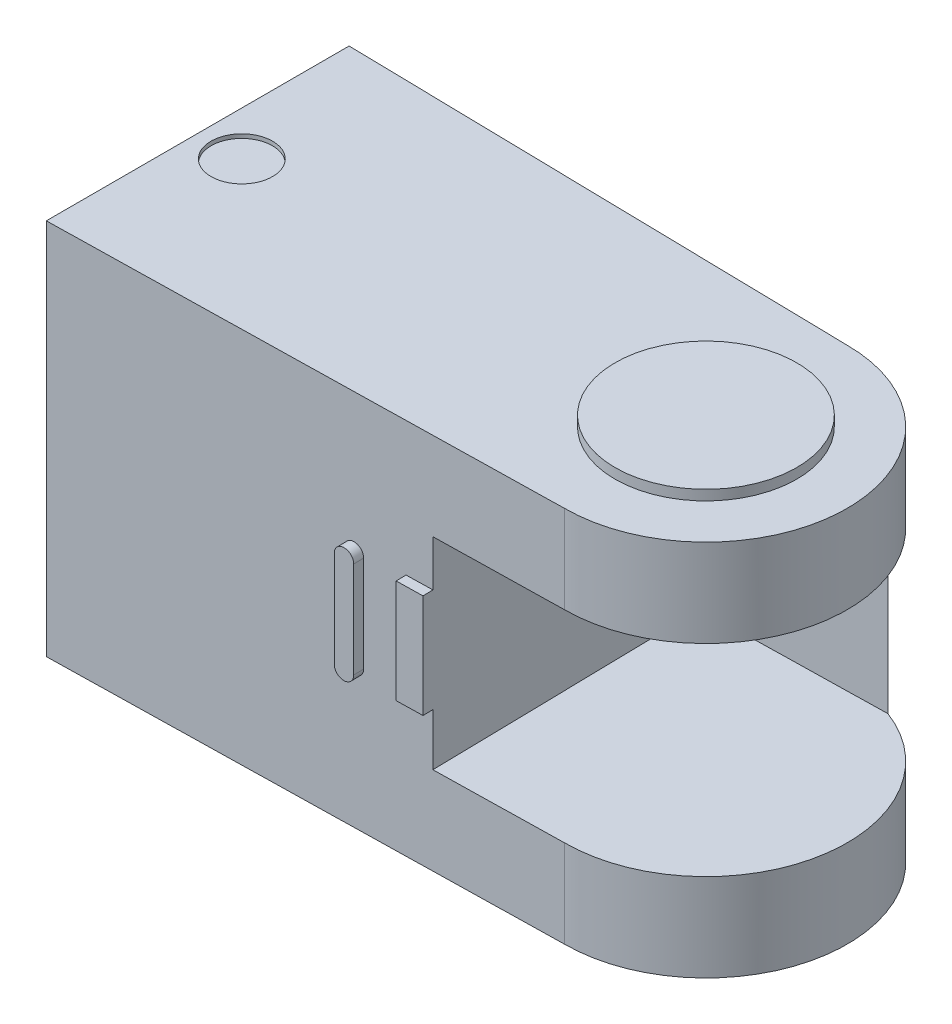
from build123d import *

# Parameters (mm, degrees)
BOSS_EXTRUDE1_DEPTH = 187
CUT_EXTRUDE3_DEPTH  = 135
SKETCH3_W           = 208.90375788
SKETCH3_H           = 100
CUT_EXTRUDE4_DEPTH  = 175
SKETCH4_R           = 45
BOSS_EXTRUDE2_DEPTH = 5
BOSS_EXTRUDE3_START = 5
SKETCH5_R           = 45
BOSS_EXTRUDE3_DEPTH = 5
SKETCH6_W           = 13.051719475
SKETCH6_H           = 51.345683967
BOSS_EXTRUDE4_DEPTH = 5
BOSS_EXTRUDE5_DEPTH = 5
SKETCH8_R           = 15.225
CUT_EXTRUDE6_DEPTH  = 2


with BuildPart() as part:
    # Sketch1 → Boss-Extrude1 (new body)
    with BuildSketch(Plane(origin=(0, 0, 0), x_dir=(1, 0, 0), z_dir=(0, 1, 0))):
        with BuildLine():
            Line((0, 70), (-251.769125683, 75))
            Line((-251.769125683, 75), (-251.769125683, -75))
            Line((-251.769125683, -75), (0, -70))
            ThreePointArc((0, -70), (70, 0), (0, 70))
        make_face()
    extrude(amount=-BOSS_EXTRUDE1_DEPTH)

    # Sketch2 → Cut-Extrude3 (cut)
    with BuildSketch(Plane(origin=(1.38961445, 0, 69.972403001), x_dir=(0.9998028591480678, 0, -0.019855549333850253), z_dir=(0.019855549333850253, 0, 0.9998028591480679))):
        Polygon((-1.389888453, -43.5), (169.277022147, -43.5), (169.277022147, -143.5), (-1.389888453, -143.5), (-65.389888453, -143.5), (-65.389888453, -43.5), align=None)
    extrude(amount=-CUT_EXTRUDE3_DEPTH, mode=Mode.SUBTRACT)

    # Sketch3 → Cut-Extrude4 (cut)
    with BuildSketch(Plane(origin=(-1.29088471, 0, -65.000982984), x_dir=(0.9998028591480678, 0, -0.019855549333850163), z_dir=(0.019855549333850163, 0, 0.9998028591480679))):
        with Locations((39.061990487, -93.5)):
            Rectangle(SKETCH3_W, SKETCH3_H)
    extrude(amount=CUT_EXTRUDE4_DEPTH, mode=Mode.SUBTRACT)

    # Sketch4 → Boss-Extrude2 (add)
    with BuildSketch(Plane(origin=(0, 0, 0), x_dir=(1, 0, 0), z_dir=(0, 1, 0))):
        with Locations(Location((0, 0, 0), (0, 0, 270))):
            Circle(SKETCH4_R)
    extrude(amount=BOSS_EXTRUDE2_DEPTH)

    # Sketch5 → Boss-Extrude3 (add)
    with BuildSketch(Plane.XZ.offset(187).offset(BOSS_EXTRUDE3_START)):
        with Locations(Location((0, 0, 0), (0, 0, 90))):
            Circle(SKETCH5_R)
    extrude(amount=-BOSS_EXTRUDE3_DEPTH)

    # Sketch6 → Boss-Extrude4 (add)
    with BuildSketch(Plane(origin=(1.38961445, 0, 69.972403001), x_dir=(0.9998028591480678, 0, -0.019855549333850253), z_dir=(0.019855549333850253, 0, 0.9998028591480679))):
        with Locations((-71.915748191, -92.016210874)):
            Rectangle(SKETCH6_W, SKETCH6_H)
    extrude(amount=BOSS_EXTRUDE4_DEPTH)

    # Sketch7 → Boss-Extrude5 (add)
    with BuildSketch(Plane(origin=(1.38961445, 0, 69.972403001), x_dir=(0.9998028591480678, 0, -0.019855549333850253), z_dir=(0.019855549333850253, 0, 0.9998028591480679))):
        with BuildLine():
            Line((-108.508236533, -116.799531344), (-108.508236533, -69.172508895))
            ThreePointArc((-108.508236533, -69.172508895), (-103.774379298, -64.438651661), (-99.040522064, -69.172508895))
            Line((-99.040522064, -69.172508895), (-99.040522064, -116.799531344))
            ThreePointArc((-99.040522064, -116.799531344), (-103.774379298, -121.533388578), (-108.508236533, -116.799531344))
        make_face()
    extrude(amount=BOSS_EXTRUDE5_DEPTH)

    # Sketch8 → Cut-Extrude6 (cut)
    with BuildSketch(Plane(origin=(0, 0, 0), x_dir=(1, 0, 0), z_dir=(0, 1, 0))):
        with Locations(Location((-229.928260902, 0, 0), (0, 0, 270))):
            Circle(SKETCH8_R)
    extrude(amount=-CUT_EXTRUDE6_DEPTH, mode=Mode.SUBTRACT)


solid = part.part
